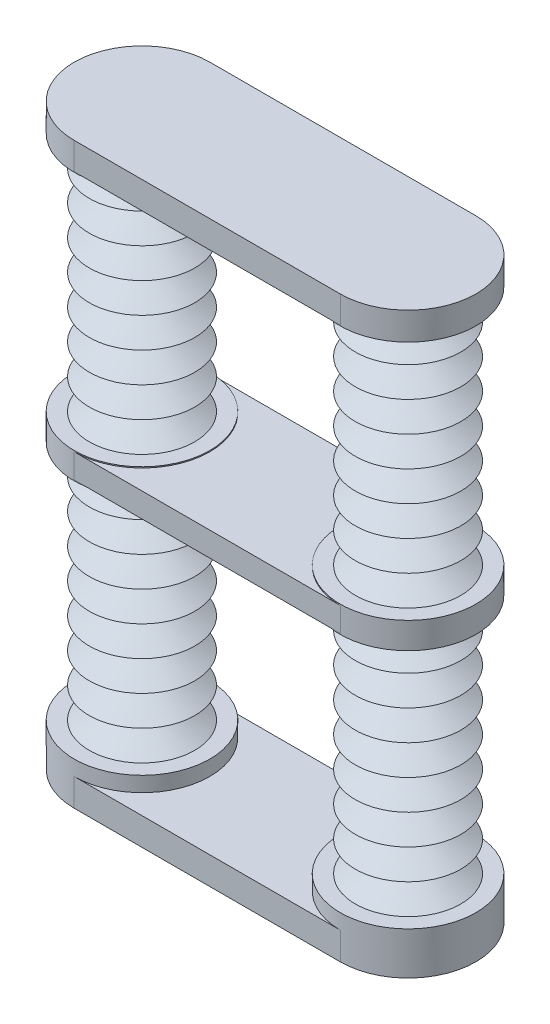
from build123d import *
from build123d.topology import SkipClean

# Parameters (mm, degrees)
BOSS_EXTRUDE9_START       = 91.318875688
BOSS_EXTRUDE9_DEPTH       = 91.318875688
BOSS_EXTRUDE10_DEPTH      = 40
BOSS_EXTRUDE10_DEPTH_BACK = 40.54431727
SKETCH11_W                = 883.198828216
SKETCH11_H                = 450
BOSS_EXTRUDE11_DEPTH      = 42
BOSS_EXTRUDE11_DEPTH_BACK = 48
SCALE1_SCALE              = 0.055


with BuildPart() as part:
    # Sketch1 → Revolve1 (revolve)
    with BuildSketch(Plane.XY):
        Polygon((-166.599414108, 5.011103152), (58.400585892, 5.011103152), (58.400585892, 55.011103152), (-41.599414108, 55.011103152), (45.00312627, 105.011103152), (-41.599414108, 155.011103152), (45.00312627, 205.011103152), (-41.599414108, 255.011103152), (45.00312627, 305.011103152), (-41.599414108, 355.011103152), (45.00312627, 405.011103152), (-41.587604021, 454.881711508), (-116.587604021, 454.881711508), (-29.99687373, 405.011103152), (-116.599414108, 355.011103152), (-29.99687373, 305.011103152), (-116.599414108, 255.011103152), (-29.99687373, 205.011103152), (-116.599414108, 155.011103152), (-29.99687373, 105.011103152), (-116.599414108, 55.011103152), (-166.599414108, 55.011103152), align=None)
    revolve1 = revolve(axis=Axis((58.400585892, 5.011103152, 0), (0, 1, 0)))

    # Mirror1: Revolve1 across plane
    add(revolve1.mirror(Plane(origin=(-116.587604021, 454.881711508, 0), x_dir=(0, 0, 1), z_dir=(0, -1, 0))))


with BuildPart() as body_2:
    # Mirror25: mirrored copy
    add(part.part.mirror(Plane(origin=(500, 0, 0), x_dir=(0, 0, 1), z_dir=(1, 0, 0))))


with BuildPart() as body_3:
    # Mirror28: mirrored copy
    add(part.part.mirror(Plane.ZX.offset(11.366748274)))


with BuildPart() as body_4:
    # Mirror28 2: mirrored copy
    add(body_2.part.mirror(Plane.ZX.offset(11.366748274)))


with BuildPart() as part_1:
    add(part.part)

    # Combine2: union body 3
    add(body_3.part)



with BuildPart() as body_2_1:
    add(body_2.part)

    # Combine3: union body 4
    add(body_4.part)


with BuildPart() as part_2:
    with SkipClean():  # the faces are left unmerged after this step: merging them gives an invalid solid
        add(part_1.part)

        add(body_2_1.part)  # Boss-Extrude9 merges body 2
        # Sketch23 → Boss-Extrude9 (add)
        with BuildSketch(Plane(origin=(0, -882.018823317, 0), x_dir=(-1, 0, 0), z_dir=(0, -1, 0)).offset(BOSS_EXTRUDE9_START)):
            with BuildLine():
                Line((-58.400585892, 225), (-941.599414108, 225))
                ThreePointArc((-941.599414108, 225), (-1166.599414108, 0), (-941.599414108, -225))
                Line((-941.599414108, -225), (-58.400585892, -225))
                ThreePointArc((-58.400585892, -225), (166.599414108, 0), (-58.400585892, 225))
            make_face()
        extrude(amount=-BOSS_EXTRUDE9_DEPTH)

    # Sketch11 → Boss-Extrude10 (add, two sides: drawn at the far end of the back side and taken through both)
    with SkipClean():  # the faces are left unmerged after this step: merging them gives an invalid solid
        with BuildSketch(Plane(origin=(0, 11.366748274, 0), x_dir=(1, 0, 0), z_dir=(0, 1, 0)).offset(-BOSS_EXTRUDE10_DEPTH_BACK)):
            with Locations((500, 0)):
                Rectangle(SKETCH11_W, SKETCH11_H)
        extrude(amount=BOSS_EXTRUDE10_DEPTH + BOSS_EXTRUDE10_DEPTH_BACK)

    # Sketch22 → Boss-Extrude11 (add, two sides: drawn at the far end of the back side and taken through both)
    with SkipClean():  # the faces are left unmerged after this step: merging them gives an invalid solid
        with BuildSketch(Plane(origin=(0, 904.752319865, 0), x_dir=(1, 0, 0), z_dir=(0, 1, 0)).offset(-BOSS_EXTRUDE11_DEPTH_BACK)):
            with BuildLine():
                Line((941.599414108, 225), (58.400585892, 225))
                ThreePointArc((58.400585892, 225), (-166.599414108, 0), (58.400585892, -225))
                Line((58.400585892, -225), (941.599414108, -225))
                ThreePointArc((941.599414108, -225), (1166.599414108, 0), (941.599414108, 225))
            make_face()
        extrude(amount=BOSS_EXTRUDE11_DEPTH + BOSS_EXTRUDE11_DEPTH_BACK)


with BuildPart() as part_3:
    # Scale1: scaled about (500, -42.173888946, 0)
    add(part_2.part.scale(SCALE1_SCALE).moved(Location((472.5, -39.854325054, 0))))


solid = part_3.part
